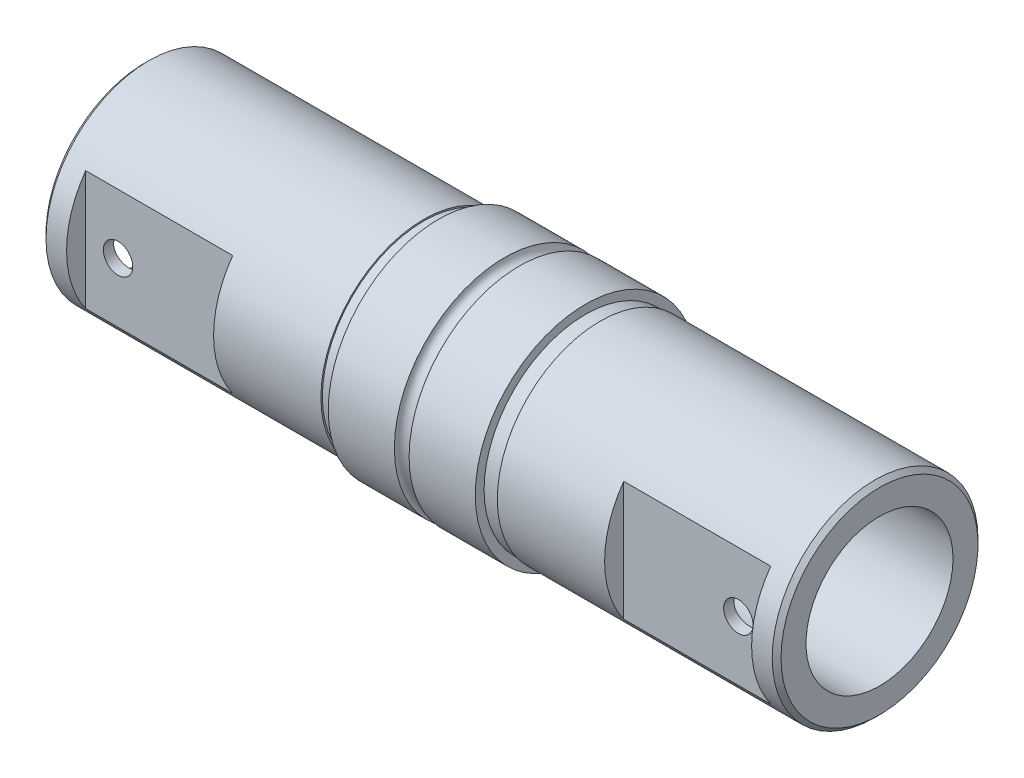
from build123d import *

# Parameters (mm, degrees)
CHAFL_N2_SIZE          = 1.5
CHAFL_N3_SIZE          = 1.5
CROQUIS2_R             = 2.5
CROQUIS2_W             = 5
CROQUIS2_H             = 0.5
CROQUIS5_R             = 25
CORTAR_EXTRUIR5_DEPTH  = 300
CROQUIS3_W             = 50
CROQUIS3_H             = 50
CORTAR_EXTRUIR9_DEPTH  = 6.5
CROQUIS7_R             = 5
CORTAR_EXTRUIR12_DEPTH = 46.5


with BuildPart() as part:
    # Croquis1 → Revolución1 (revolve)
    with BuildSketch(Plane(origin=(0, 0, 0), x_dir=(1, 0, 0), z_dir=(0, 1, 0)), mode=Mode.PRIVATE) as revoluci_n1_sk:
        Polygon((-25, 37.5), (25, 37.5), (25, 35), (125, 35), (125, 0), (-125, 0), (-125, 35), (-25, 35), align=None)
    revolve(revoluci_n1_sk.sketch.rotate(Axis((-200, 0, 0), (1, 0, 0)), 180), axis=Axis((-200, 0, 0), (1, 0, 0)))

    # Chaflán2
    chafl_n2_edges = [part.edges().sort_by_distance(p)[0] for p in [
        (-125, 0, -35),
    ]]
    chamfer(chafl_n2_edges, length=CHAFL_N2_SIZE)

    # Chaflán3
    chafl_n3_edges = [part.edges().sort_by_distance(p)[0] for p in [
        (125, 0, -35),
    ]]
    chamfer(chafl_n3_edges, length=CHAFL_N3_SIZE)

    # Croquis2 → Cortar-Revolución1 (revolve, cut)
    with BuildSketch(Plane.XY, mode=Mode.PRIVATE) as cortar_revoluci_n1_sk:
        with Locations((0, 37.5)):
            Circle(CROQUIS2_R)
        with Locations((-27.5, 34.75)):
            Rectangle(CROQUIS2_W, CROQUIS2_H)
        with Locations((27.5, 34.75)):
            Rectangle(CROQUIS2_W, CROQUIS2_H)
    revolve(cortar_revoluci_n1_sk.sketch.rotate(Axis((-200, 0, 0), (1, 0, 0)), 90), axis=Axis((-200, 0, 0), (1, 0, 0)), mode=Mode.SUBTRACT)

    # Croquis5 → Cortar-Extruir5 (cut)
    with BuildSketch(Plane(origin=(125, 0, 0), x_dir=(0, 0, -1), z_dir=(1, 0, 0))):
        Circle(CROQUIS5_R)
    extrude(amount=-CORTAR_EXTRUIR5_DEPTH, mode=Mode.SUBTRACT)

    # Croquis3 → Cortar-Extruir9 (cut)
    with BuildSketch(Plane.XY.offset(35)):
        with Locations((91.5, 0)):
            Rectangle(CROQUIS3_W, CROQUIS3_H)
        with Locations((-91.5, 0)):
            Rectangle(CROQUIS3_W, CROQUIS3_H)
    extrude(amount=-CORTAR_EXTRUIR9_DEPTH, mode=Mode.SUBTRACT)

    # Croquis7 → Cortar-Extruir12 (cut)
    with BuildSketch(Plane.XY.offset(28.5)):
        with Locations((-105.5, 0)):
            Circle(CROQUIS7_R)
        with Locations((105.5, 0)):
            Circle(CROQUIS7_R)
    extrude(amount=-CORTAR_EXTRUIR12_DEPTH, mode=Mode.SUBTRACT)


solid = part.part
